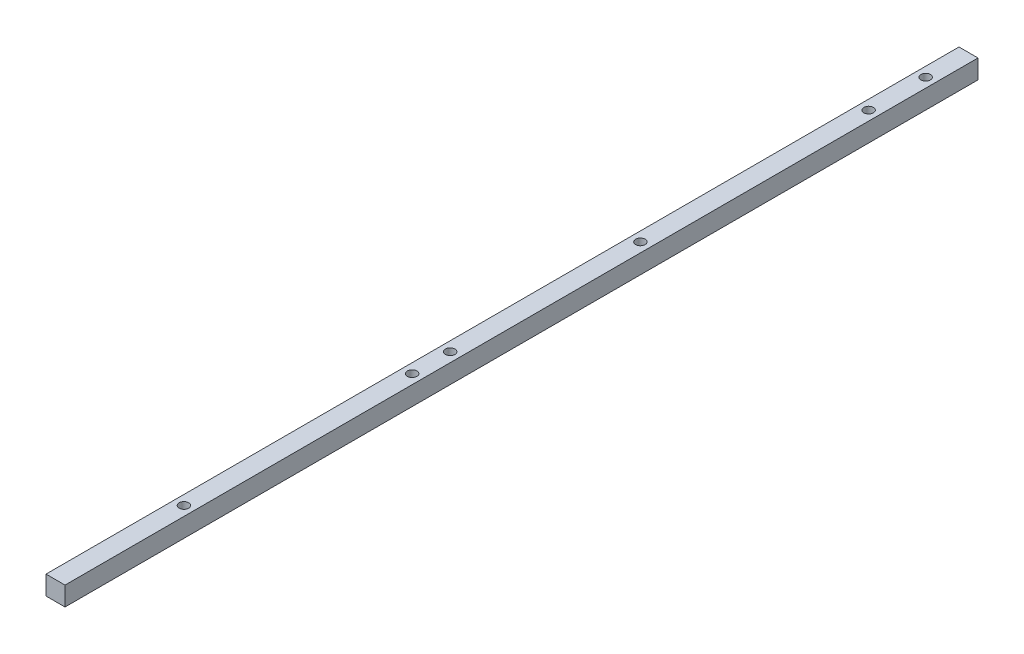
from build123d import *

# Parameters (mm, degrees)
SKETCH1_W           = 6.35
SKETCH1_H           = 304.8
SKETCH1_R           = 1.5875
BOSS_EXTRUDE1_DEPTH = 6.35


with BuildPart() as part:
    # Sketch1 → Boss-Extrude1 (new body)
    with BuildSketch(Plane(origin=(0, 0, 0), x_dir=(1, 0, 0), z_dir=(0, 1, 0))):
        with Locations((3.175, 152.4)):
            Rectangle(SKETCH1_W, SKETCH1_H)
        with Locations(Location((3.175, 271.4625, 0), (0, 0, 270))):
            Circle(SKETCH1_R, mode=Mode.SUBTRACT)
        with Locations(Location((3.175, 195.2625, 0), (0, 0, 270))):
            Circle(SKETCH1_R, mode=Mode.SUBTRACT)
        with Locations(Location((3.175, 119.0625, 0), (0, 0, 270))):
            Circle(SKETCH1_R, mode=Mode.SUBTRACT)
        with Locations(Location((3.175, 42.8625, 0), (0, 0, 270))):
            Circle(SKETCH1_R, mode=Mode.SUBTRACT)
        with Locations(Location((3.175, 290.5125, 0), (0, 0, 270))):
            Circle(SKETCH1_R, mode=Mode.SUBTRACT)
        with Locations(Location((3.175, 131.7625, 0), (0, 0, 270))):
            Circle(SKETCH1_R, mode=Mode.SUBTRACT)
    extrude(amount=BOSS_EXTRUDE1_DEPTH)


solid = part.part
